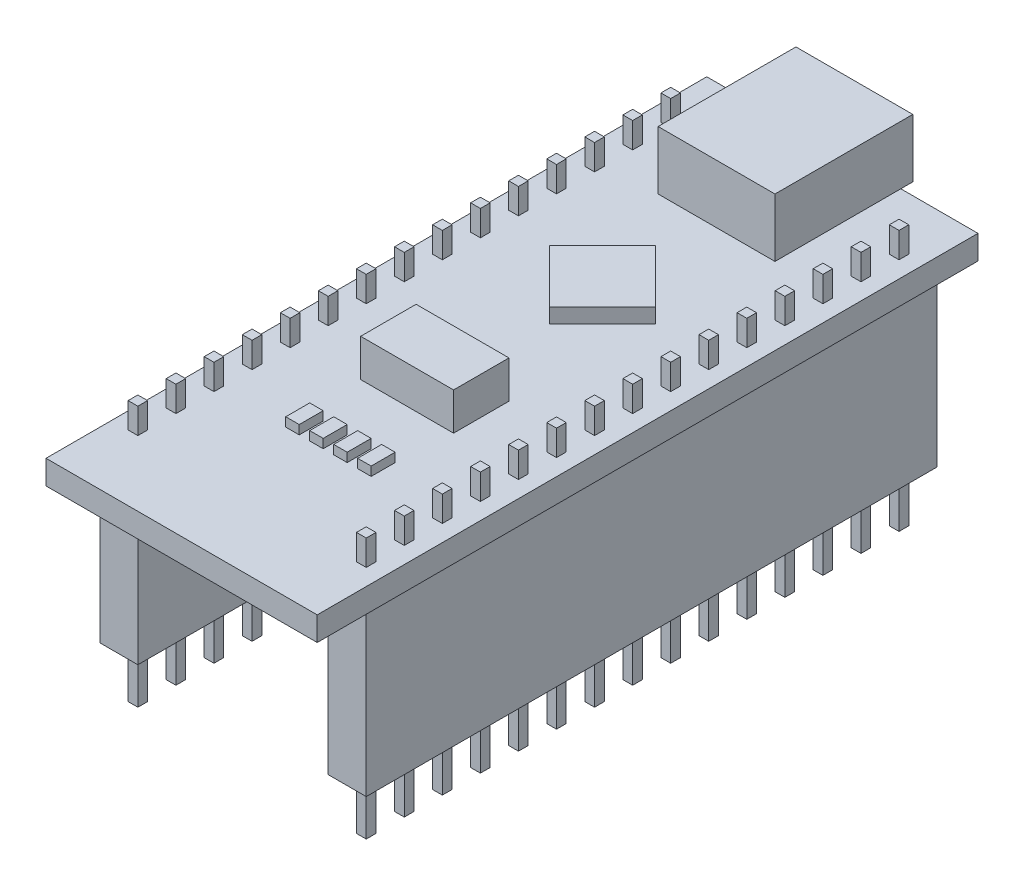
from build123d import *

# Parameters (mm, degrees)
ESQUISSE1_W                = 18.1
ESQUISSE1_H                = 44.1
BOSS_EXTRU_1_DEPTH         = 1.6
BOSS_EXTRU_2_DEPTH         = 14.1
BOSS_EXTRU_2_DEPTH_BACK    = 3.3
ESQUISSE2_W                = 0.65
ESQUISSE2_H                = 0.65
BOSS_EXTRU_2_2_DEPTH       = 14.1
BOSS_EXTRU_2_2_DEPTH_BACK  = 3.3
BOSS_EXTRU_2_3_DEPTH       = 14.1
BOSS_EXTRU_2_3_DEPTH_BACK  = 3.3
BOSS_EXTRU_2_4_DEPTH       = 14.1
BOSS_EXTRU_2_4_DEPTH_BACK  = 3.3
BOSS_EXTRU_2_5_DEPTH       = 14.1
BOSS_EXTRU_2_5_DEPTH_BACK  = 3.3
BOSS_EXTRU_2_6_DEPTH       = 14.1
BOSS_EXTRU_2_6_DEPTH_BACK  = 3.3
BOSS_EXTRU_2_7_DEPTH       = 14.1
BOSS_EXTRU_2_7_DEPTH_BACK  = 3.3
BOSS_EXTRU_2_8_DEPTH       = 14.1
BOSS_EXTRU_2_8_DEPTH_BACK  = 3.3
BOSS_EXTRU_2_9_DEPTH       = 14.1
BOSS_EXTRU_2_9_DEPTH_BACK  = 3.3
BOSS_EXTRU_2_10_DEPTH      = 14.1
BOSS_EXTRU_2_10_DEPTH_BACK = 3.3
BOSS_EXTRU_2_11_DEPTH      = 14.1
BOSS_EXTRU_2_11_DEPTH_BACK = 3.3
BOSS_EXTRU_2_12_DEPTH      = 14.1
BOSS_EXTRU_2_12_DEPTH_BACK = 3.3
BOSS_EXTRU_2_13_DEPTH      = 14.1
BOSS_EXTRU_2_13_DEPTH_BACK = 3.3
BOSS_EXTRU_2_14_DEPTH      = 14.1
BOSS_EXTRU_2_14_DEPTH_BACK = 3.3
BOSS_EXTRU_2_15_DEPTH      = 14.1
BOSS_EXTRU_2_15_DEPTH_BACK = 3.3
BOSS_EXTRU_2_16_DEPTH      = 14.1
BOSS_EXTRU_2_16_DEPTH_BACK = 3.3
BOSS_EXTRU_2_17_DEPTH      = 14.1
BOSS_EXTRU_2_17_DEPTH_BACK = 3.3
BOSS_EXTRU_2_18_DEPTH      = 14.1
BOSS_EXTRU_2_18_DEPTH_BACK = 3.3
BOSS_EXTRU_2_19_DEPTH      = 14.1
BOSS_EXTRU_2_19_DEPTH_BACK = 3.3
BOSS_EXTRU_2_20_DEPTH      = 14.1
BOSS_EXTRU_2_20_DEPTH_BACK = 3.3
BOSS_EXTRU_2_21_DEPTH      = 14.1
BOSS_EXTRU_2_21_DEPTH_BACK = 3.3
BOSS_EXTRU_2_22_DEPTH      = 14.1
BOSS_EXTRU_2_22_DEPTH_BACK = 3.3
BOSS_EXTRU_2_23_DEPTH      = 14.1
BOSS_EXTRU_2_23_DEPTH_BACK = 3.3
BOSS_EXTRU_2_24_DEPTH      = 14.1
BOSS_EXTRU_2_24_DEPTH_BACK = 3.3
BOSS_EXTRU_2_25_DEPTH      = 14.1
BOSS_EXTRU_2_25_DEPTH_BACK = 3.3
BOSS_EXTRU_2_26_DEPTH      = 14.1
BOSS_EXTRU_2_26_DEPTH_BACK = 3.3
BOSS_EXTRU_2_27_DEPTH      = 14.1
BOSS_EXTRU_2_27_DEPTH_BACK = 3.3
BOSS_EXTRU_2_28_DEPTH      = 14.1
BOSS_EXTRU_2_28_DEPTH_BACK = 3.3
BOSS_EXTRU_2_29_DEPTH      = 14.1
BOSS_EXTRU_2_29_DEPTH_BACK = 3.3
BOSS_EXTRU_2_30_DEPTH      = 14.1
BOSS_EXTRU_2_30_DEPTH_BACK = 3.3
ESQUISSE3_W                = 2.54
ESQUISSE3_H                = 38.1
BOSS_EXTRU_3_DEPTH         = 10.7
BOSS_EXTRU_3_2_DEPTH       = 10.7
ESQUISSE4_W                = 7.8
ESQUISSE4_H                = 9.2
BOSS_EXTRU_4_DEPTH         = 3.9
BOSS_EXTRU_5_DEPTH         = 1
ESQUISSE6_W                = 6.2
ESQUISSE6_H                = 3.7
BOSS_EXTRU_6_DEPTH         = 2.5
ESQUISSE7_W                = 0.9
ESQUISSE7_H                = 1.6
BOSS_EXTRU_7_DEPTH         = 0.6
BOSS_EXTRU_7_2_DEPTH       = 0.6
BOSS_EXTRU_7_3_DEPTH       = 0.6
BOSS_EXTRU_7_4_DEPTH       = 0.6
ESQUISSE8_W                = 6.067722864
ESQUISSE8_H                = 10.2
BOSS_EXTRU_8_DEPTH         = 1.7
ESQUISSE8_W_2              = 5.5
ESQUISSE8_H_2              = 4.1
BOSS_EXTRU_8_2_DEPTH       = 1.7
ESQUISSE8_W_3              = 1.409672989
BOSS_EXTRU_8_3_DEPTH       = 1.7


with BuildPart() as part:
    # Esquisse1 → Boss.-Extru.1 (new body)
    with BuildSketch(Plane(origin=(0, 0, 0), x_dir=(1, 0, 0), z_dir=(0, 1, 0))):
        Rectangle(ESQUISSE1_W, ESQUISSE1_H)
    extrude(amount=BOSS_EXTRU_1_DEPTH)


with BuildPart() as body_2:
    # Esquisse2 → Boss.-Extru.2 (new, two sides: drawn at the far end of the back side and taken through both)
    with BuildSketch(Plane.XZ.offset(-BOSS_EXTRU_2_DEPTH_BACK)):
        with Locations((-7.62, 17.35)):
            Rectangle(ESQUISSE2_W, ESQUISSE2_H)
    extrude(amount=BOSS_EXTRU_2_DEPTH + BOSS_EXTRU_2_DEPTH_BACK)


with BuildPart() as body_3:
    # Esquisse2 → Boss.-Extru.2 2 (new, two sides: drawn at the far end of the back side and taken through both)
    with BuildSketch(Plane.XZ.offset(-BOSS_EXTRU_2_2_DEPTH_BACK)):
        with Locations((7.62, 17.35)):
            Rectangle(ESQUISSE2_W, ESQUISSE2_H)
    extrude(amount=BOSS_EXTRU_2_2_DEPTH + BOSS_EXTRU_2_2_DEPTH_BACK)


with BuildPart() as body_4:
    # Esquisse2 → Boss.-Extru.2 3 (new, two sides: drawn at the far end of the back side and taken through both)
    with BuildSketch(Plane.XZ.offset(-BOSS_EXTRU_2_3_DEPTH_BACK)):
        with Locations((-7.62, 14.81)):
            Rectangle(ESQUISSE2_W, ESQUISSE2_H)
    extrude(amount=BOSS_EXTRU_2_3_DEPTH + BOSS_EXTRU_2_3_DEPTH_BACK)


with BuildPart() as body_5:
    # Esquisse2 → Boss.-Extru.2 4 (new, two sides: drawn at the far end of the back side and taken through both)
    with BuildSketch(Plane.XZ.offset(-BOSS_EXTRU_2_4_DEPTH_BACK)):
        with Locations((7.62, 14.81)):
            Rectangle(ESQUISSE2_W, ESQUISSE2_H)
    extrude(amount=BOSS_EXTRU_2_4_DEPTH + BOSS_EXTRU_2_4_DEPTH_BACK)


with BuildPart() as body_6:
    # Esquisse2 → Boss.-Extru.2 5 (new, two sides: drawn at the far end of the back side and taken through both)
    with BuildSketch(Plane.XZ.offset(-BOSS_EXTRU_2_5_DEPTH_BACK)):
        with Locations((-7.62, 12.27)):
            Rectangle(ESQUISSE2_W, ESQUISSE2_H)
    extrude(amount=BOSS_EXTRU_2_5_DEPTH + BOSS_EXTRU_2_5_DEPTH_BACK)


with BuildPart() as body_7:
    # Esquisse2 → Boss.-Extru.2 6 (new, two sides: drawn at the far end of the back side and taken through both)
    with BuildSketch(Plane.XZ.offset(-BOSS_EXTRU_2_6_DEPTH_BACK)):
        with Locations((7.62, 12.27)):
            Rectangle(ESQUISSE2_W, ESQUISSE2_H)
    extrude(amount=BOSS_EXTRU_2_6_DEPTH + BOSS_EXTRU_2_6_DEPTH_BACK)


with BuildPart() as body_8:
    # Esquisse2 → Boss.-Extru.2 7 (new, two sides: drawn at the far end of the back side and taken through both)
    with BuildSketch(Plane.XZ.offset(-BOSS_EXTRU_2_7_DEPTH_BACK)):
        with Locations((-7.62, 9.73)):
            Rectangle(ESQUISSE2_W, ESQUISSE2_H)
    extrude(amount=BOSS_EXTRU_2_7_DEPTH + BOSS_EXTRU_2_7_DEPTH_BACK)


with BuildPart() as body_9:
    # Esquisse2 → Boss.-Extru.2 8 (new, two sides: drawn at the far end of the back side and taken through both)
    with BuildSketch(Plane.XZ.offset(-BOSS_EXTRU_2_8_DEPTH_BACK)):
        with Locations((7.62, 9.73)):
            Rectangle(ESQUISSE2_W, ESQUISSE2_H)
    extrude(amount=BOSS_EXTRU_2_8_DEPTH + BOSS_EXTRU_2_8_DEPTH_BACK)


with BuildPart() as body_10:
    # Esquisse2 → Boss.-Extru.2 9 (new, two sides: drawn at the far end of the back side and taken through both)
    with BuildSketch(Plane.XZ.offset(-BOSS_EXTRU_2_9_DEPTH_BACK)):
        with Locations((-7.62, 7.19)):
            Rectangle(ESQUISSE2_W, ESQUISSE2_H)
    extrude(amount=BOSS_EXTRU_2_9_DEPTH + BOSS_EXTRU_2_9_DEPTH_BACK)


with BuildPart() as body_11:
    # Esquisse2 → Boss.-Extru.2 10 (new, two sides: drawn at the far end of the back side and taken through both)
    with BuildSketch(Plane.XZ.offset(-BOSS_EXTRU_2_10_DEPTH_BACK)):
        with Locations((7.62, 7.19)):
            Rectangle(ESQUISSE2_W, ESQUISSE2_H)
    extrude(amount=BOSS_EXTRU_2_10_DEPTH + BOSS_EXTRU_2_10_DEPTH_BACK)


with BuildPart() as body_12:
    # Esquisse2 → Boss.-Extru.2 11 (new, two sides: drawn at the far end of the back side and taken through both)
    with BuildSketch(Plane.XZ.offset(-BOSS_EXTRU_2_11_DEPTH_BACK)):
        with Locations((-7.62, 4.65)):
            Rectangle(ESQUISSE2_W, ESQUISSE2_H)
    extrude(amount=BOSS_EXTRU_2_11_DEPTH + BOSS_EXTRU_2_11_DEPTH_BACK)


with BuildPart() as body_13:
    # Esquisse2 → Boss.-Extru.2 12 (new, two sides: drawn at the far end of the back side and taken through both)
    with BuildSketch(Plane.XZ.offset(-BOSS_EXTRU_2_12_DEPTH_BACK)):
        with Locations((7.62, 4.65)):
            Rectangle(ESQUISSE2_W, ESQUISSE2_H)
    extrude(amount=BOSS_EXTRU_2_12_DEPTH + BOSS_EXTRU_2_12_DEPTH_BACK)


with BuildPart() as body_14:
    # Esquisse2 → Boss.-Extru.2 13 (new, two sides: drawn at the far end of the back side and taken through both)
    with BuildSketch(Plane.XZ.offset(-BOSS_EXTRU_2_13_DEPTH_BACK)):
        with Locations((-7.62, 2.11)):
            Rectangle(ESQUISSE2_W, ESQUISSE2_H)
    extrude(amount=BOSS_EXTRU_2_13_DEPTH + BOSS_EXTRU_2_13_DEPTH_BACK)


with BuildPart() as body_15:
    # Esquisse2 → Boss.-Extru.2 14 (new, two sides: drawn at the far end of the back side and taken through both)
    with BuildSketch(Plane.XZ.offset(-BOSS_EXTRU_2_14_DEPTH_BACK)):
        with Locations((7.62, 2.11)):
            Rectangle(ESQUISSE2_W, ESQUISSE2_H)
    extrude(amount=BOSS_EXTRU_2_14_DEPTH + BOSS_EXTRU_2_14_DEPTH_BACK)


with BuildPart() as body_16:
    # Esquisse2 → Boss.-Extru.2 15 (new, two sides: drawn at the far end of the back side and taken through both)
    with BuildSketch(Plane.XZ.offset(-BOSS_EXTRU_2_15_DEPTH_BACK)):
        with Locations((-7.62, -0.43)):
            Rectangle(ESQUISSE2_W, ESQUISSE2_H)
    extrude(amount=BOSS_EXTRU_2_15_DEPTH + BOSS_EXTRU_2_15_DEPTH_BACK)


with BuildPart() as body_17:
    # Esquisse2 → Boss.-Extru.2 16 (new, two sides: drawn at the far end of the back side and taken through both)
    with BuildSketch(Plane.XZ.offset(-BOSS_EXTRU_2_16_DEPTH_BACK)):
        with Locations((7.62, -0.43)):
            Rectangle(ESQUISSE2_W, ESQUISSE2_H)
    extrude(amount=BOSS_EXTRU_2_16_DEPTH + BOSS_EXTRU_2_16_DEPTH_BACK)


with BuildPart() as body_18:
    # Esquisse2 → Boss.-Extru.2 17 (new, two sides: drawn at the far end of the back side and taken through both)
    with BuildSketch(Plane.XZ.offset(-BOSS_EXTRU_2_17_DEPTH_BACK)):
        with Locations((-7.62, -2.97)):
            Rectangle(ESQUISSE2_W, ESQUISSE2_H)
    extrude(amount=BOSS_EXTRU_2_17_DEPTH + BOSS_EXTRU_2_17_DEPTH_BACK)


with BuildPart() as body_19:
    # Esquisse2 → Boss.-Extru.2 18 (new, two sides: drawn at the far end of the back side and taken through both)
    with BuildSketch(Plane.XZ.offset(-BOSS_EXTRU_2_18_DEPTH_BACK)):
        with Locations((7.62, -2.97)):
            Rectangle(ESQUISSE2_W, ESQUISSE2_H)
    extrude(amount=BOSS_EXTRU_2_18_DEPTH + BOSS_EXTRU_2_18_DEPTH_BACK)


with BuildPart() as body_20:
    # Esquisse2 → Boss.-Extru.2 19 (new, two sides: drawn at the far end of the back side and taken through both)
    with BuildSketch(Plane.XZ.offset(-BOSS_EXTRU_2_19_DEPTH_BACK)):
        with Locations((-7.62, -5.51)):
            Rectangle(ESQUISSE2_W, ESQUISSE2_H)
    extrude(amount=BOSS_EXTRU_2_19_DEPTH + BOSS_EXTRU_2_19_DEPTH_BACK)


with BuildPart() as body_21:
    # Esquisse2 → Boss.-Extru.2 20 (new, two sides: drawn at the far end of the back side and taken through both)
    with BuildSketch(Plane.XZ.offset(-BOSS_EXTRU_2_20_DEPTH_BACK)):
        with Locations((7.62, -5.51)):
            Rectangle(ESQUISSE2_W, ESQUISSE2_H)
    extrude(amount=BOSS_EXTRU_2_20_DEPTH + BOSS_EXTRU_2_20_DEPTH_BACK)


with BuildPart() as body_22:
    # Esquisse2 → Boss.-Extru.2 21 (new, two sides: drawn at the far end of the back side and taken through both)
    with BuildSketch(Plane.XZ.offset(-BOSS_EXTRU_2_21_DEPTH_BACK)):
        with Locations((-7.62, -8.05)):
            Rectangle(ESQUISSE2_W, ESQUISSE2_H)
    extrude(amount=BOSS_EXTRU_2_21_DEPTH + BOSS_EXTRU_2_21_DEPTH_BACK)


with BuildPart() as body_23:
    # Esquisse2 → Boss.-Extru.2 22 (new, two sides: drawn at the far end of the back side and taken through both)
    with BuildSketch(Plane.XZ.offset(-BOSS_EXTRU_2_22_DEPTH_BACK)):
        with Locations((7.62, -8.05)):
            Rectangle(ESQUISSE2_W, ESQUISSE2_H)
    extrude(amount=BOSS_EXTRU_2_22_DEPTH + BOSS_EXTRU_2_22_DEPTH_BACK)


with BuildPart() as body_24:
    # Esquisse2 → Boss.-Extru.2 23 (new, two sides: drawn at the far end of the back side and taken through both)
    with BuildSketch(Plane.XZ.offset(-BOSS_EXTRU_2_23_DEPTH_BACK)):
        with Locations((-7.62, -10.59)):
            Rectangle(ESQUISSE2_W, ESQUISSE2_H)
    extrude(amount=BOSS_EXTRU_2_23_DEPTH + BOSS_EXTRU_2_23_DEPTH_BACK)


with BuildPart() as body_25:
    # Esquisse2 → Boss.-Extru.2 24 (new, two sides: drawn at the far end of the back side and taken through both)
    with BuildSketch(Plane.XZ.offset(-BOSS_EXTRU_2_24_DEPTH_BACK)):
        with Locations((7.62, -10.59)):
            Rectangle(ESQUISSE2_W, ESQUISSE2_H)
    extrude(amount=BOSS_EXTRU_2_24_DEPTH + BOSS_EXTRU_2_24_DEPTH_BACK)


with BuildPart() as body_26:
    # Esquisse2 → Boss.-Extru.2 25 (new, two sides: drawn at the far end of the back side and taken through both)
    with BuildSketch(Plane.XZ.offset(-BOSS_EXTRU_2_25_DEPTH_BACK)):
        with Locations((-7.62, -13.13)):
            Rectangle(ESQUISSE2_W, ESQUISSE2_H)
    extrude(amount=BOSS_EXTRU_2_25_DEPTH + BOSS_EXTRU_2_25_DEPTH_BACK)


with BuildPart() as body_27:
    # Esquisse2 → Boss.-Extru.2 26 (new, two sides: drawn at the far end of the back side and taken through both)
    with BuildSketch(Plane.XZ.offset(-BOSS_EXTRU_2_26_DEPTH_BACK)):
        with Locations((7.62, -13.13)):
            Rectangle(ESQUISSE2_W, ESQUISSE2_H)
    extrude(amount=BOSS_EXTRU_2_26_DEPTH + BOSS_EXTRU_2_26_DEPTH_BACK)


with BuildPart() as body_28:
    # Esquisse2 → Boss.-Extru.2 27 (new, two sides: drawn at the far end of the back side and taken through both)
    with BuildSketch(Plane.XZ.offset(-BOSS_EXTRU_2_27_DEPTH_BACK)):
        with Locations((-7.62, -15.67)):
            Rectangle(ESQUISSE2_W, ESQUISSE2_H)
    extrude(amount=BOSS_EXTRU_2_27_DEPTH + BOSS_EXTRU_2_27_DEPTH_BACK)


with BuildPart() as body_29:
    # Esquisse2 → Boss.-Extru.2 28 (new, two sides: drawn at the far end of the back side and taken through both)
    with BuildSketch(Plane.XZ.offset(-BOSS_EXTRU_2_28_DEPTH_BACK)):
        with Locations((7.62, -15.67)):
            Rectangle(ESQUISSE2_W, ESQUISSE2_H)
    extrude(amount=BOSS_EXTRU_2_28_DEPTH + BOSS_EXTRU_2_28_DEPTH_BACK)


with BuildPart() as body_30:
    # Esquisse2 → Boss.-Extru.2 29 (new, two sides: drawn at the far end of the back side and taken through both)
    with BuildSketch(Plane.XZ.offset(-BOSS_EXTRU_2_29_DEPTH_BACK)):
        with Locations((-7.62, -18.21)):
            Rectangle(ESQUISSE2_W, ESQUISSE2_H)
    extrude(amount=BOSS_EXTRU_2_29_DEPTH + BOSS_EXTRU_2_29_DEPTH_BACK)


with BuildPart() as body_31:
    # Esquisse2 → Boss.-Extru.2 30 (new, two sides: drawn at the far end of the back side and taken through both)
    with BuildSketch(Plane.XZ.offset(-BOSS_EXTRU_2_30_DEPTH_BACK)):
        with Locations((7.62, -18.21)):
            Rectangle(ESQUISSE2_W, ESQUISSE2_H)
    extrude(amount=BOSS_EXTRU_2_30_DEPTH + BOSS_EXTRU_2_30_DEPTH_BACK)


with BuildPart() as body_32:
    # Esquisse3 → Boss.-Extru.3 (new body)
    with BuildSketch(Plane.XZ):
        with Locations((-7.62, -0.43)):
            Rectangle(ESQUISSE3_W, ESQUISSE3_H)
    extrude(amount=BOSS_EXTRU_3_DEPTH)


with BuildPart() as body_33:
    # Esquisse3 → Boss.-Extru.3 2 (new body)
    with BuildSketch(Plane.XZ):
        with Locations((7.62, -0.43)):
            Rectangle(ESQUISSE3_W, ESQUISSE3_H)
    extrude(amount=BOSS_EXTRU_3_2_DEPTH)


with BuildPart() as body_34:
    # Esquisse4 → Boss.-Extru.4 (new body)
    with BuildSketch(Plane(origin=(0, 1.6, 0), x_dir=(1, 0, 0), z_dir=(0, 1, 0))):
        with Locations((0, 18.25)):
            Rectangle(ESQUISSE4_W, ESQUISSE4_H)
    extrude(amount=BOSS_EXTRU_4_DEPTH)


with BuildPart() as body_35:
    # Esquisse5 → Boss.-Extru.5 (new body)
    with BuildSketch(Plane(origin=(0, 1.6, 0), x_dir=(1, 0, 0), z_dir=(0, 1, 0))):
        Polygon((-3.535533906, 6.05), (0, 9.585533906), (3.535533906, 6.05), (0, 2.514466094), align=None)
    extrude(amount=BOSS_EXTRU_5_DEPTH)


with BuildPart() as body_36:
    # Esquisse6 → Boss.-Extru.6 (new body)
    with BuildSketch(Plane(origin=(0, 1.6, 0), x_dir=(1, 0, 0), z_dir=(0, 1, 0))):
        with Locations((0, -5.15)):
            Rectangle(ESQUISSE6_W, ESQUISSE6_H)
    extrude(amount=BOSS_EXTRU_6_DEPTH)


with BuildPart() as body_37:
    # Esquisse7 → Boss.-Extru.7 (new body)
    with BuildSketch(Plane(origin=(0, 1.6, 0), x_dir=(1, 0, 0), z_dir=(0, 1, 0))):
        with Locations((-2.4, -11.45)):
            Rectangle(ESQUISSE7_W, ESQUISSE7_H)
    extrude(amount=BOSS_EXTRU_7_DEPTH)


with BuildPart() as body_38:
    # Esquisse7 → Boss.-Extru.7 2 (new body)
    with BuildSketch(Plane(origin=(0, 1.6, 0), x_dir=(1, 0, 0), z_dir=(0, 1, 0))):
        with Locations((-0.8, -11.45)):
            Rectangle(ESQUISSE7_W, ESQUISSE7_H)
    extrude(amount=BOSS_EXTRU_7_2_DEPTH)


with BuildPart() as body_39:
    # Esquisse7 → Boss.-Extru.7 3 (new body)
    with BuildSketch(Plane(origin=(0, 1.6, 0), x_dir=(1, 0, 0), z_dir=(0, 1, 0))):
        with Locations((0.8, -11.45)):
            Rectangle(ESQUISSE7_W, ESQUISSE7_H)
    extrude(amount=BOSS_EXTRU_7_3_DEPTH)


with BuildPart() as body_40:
    # Esquisse7 → Boss.-Extru.7 4 (new body)
    with BuildSketch(Plane(origin=(0, 1.6, 0), x_dir=(1, 0, 0), z_dir=(0, 1, 0))):
        with Locations((2.4, -11.45)):
            Rectangle(ESQUISSE7_W, ESQUISSE7_H)
    extrude(amount=BOSS_EXTRU_7_4_DEPTH)


with BuildPart() as body_41:
    # Esquisse8 → Boss.-Extru.8 (new body)
    with BuildSketch(Plane.XZ):
        with Locations((0, -9.15)):
            Rectangle(ESQUISSE8_W, ESQUISSE8_H)
    extrude(amount=BOSS_EXTRU_8_DEPTH)


with BuildPart() as body_42:
    # Esquisse8 → Boss.-Extru.8 2 (new body)
    with BuildSketch(Plane.XZ):
        with Locations((-2.459661044, 11.8)):
            Rectangle(ESQUISSE8_W_2, ESQUISSE8_H_2)
    extrude(amount=BOSS_EXTRU_8_2_DEPTH)


with BuildPart() as body_43:
    # Esquisse8 → Boss.-Extru.8 3 (new body)
    with BuildSketch(Plane.XZ):
        with Locations((3.279021951, 11.8)):
            Rectangle(ESQUISSE8_W_3, ESQUISSE8_H_2)
    extrude(amount=BOSS_EXTRU_8_3_DEPTH)


solid = Compound([part.part, body_2.part, body_3.part, body_4.part, body_5.part, body_6.part, body_7.part, body_8.part, body_9.part, body_10.part, body_11.part, body_12.part, body_13.part, body_14.part, body_15.part, body_16.part, body_17.part, body_18.part, body_19.part, body_20.part, body_21.part, body_22.part, body_23.part, body_24.part, body_25.part, body_26.part, body_27.part, body_28.part, body_29.part, body_30.part, body_31.part, body_32.part, body_33.part, body_34.part, body_35.part, body_36.part, body_37.part, body_38.part, body_39.part, body_40.part, body_41.part, body_42.part, body_43.part])
